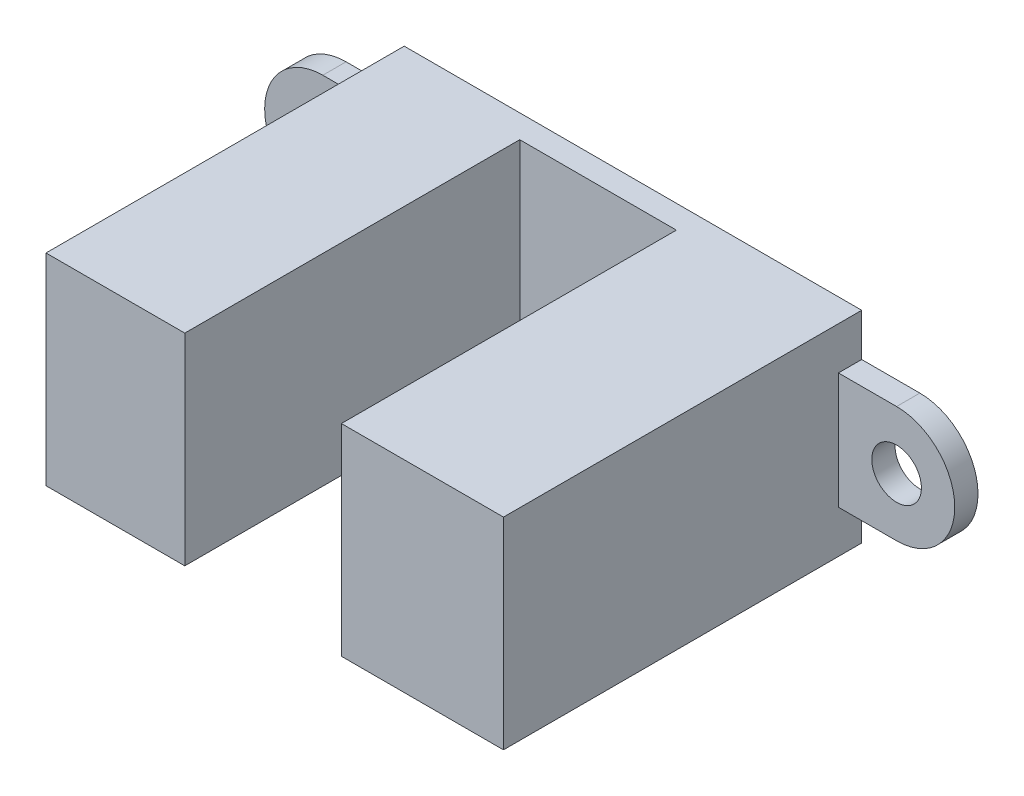
from build123d import *

# Parameters (mm, degrees)
BACK_PLATE_DEPTH               = 1.5
DETECTOR_START                 = 14.75
SKETCH2_W                      = 21.6
SKETCH2_H                      = 13
DETECTOR_SIDE_DEPTH            = 10.45
EMITTER_START                  = -14.75
SKETCH2_2_W                    = 21.6
SKETCH2_2_H                    = 13
EMITTER_SIDE_DEPTH             = 8.95
F_3_2_3_2_DIAMETER_HOLE1_D     = 3.2
F_3_2_3_2_DIAMETER_HOLE1_DEPTH = 4
F_3_2_3_2_DIAMETER_HOLE1_TIP   = 0.96137699


with BuildPart() as part:
    # Sketch1 → Back Plate (new body)
    with BuildSketch(Plane.XY):
        with BuildLine():
            ThreePointArc((-18.5, -3.75), (-15.848349571, -2.651650429), (-14.75, 0))
            ThreePointArc((-14.75, 0), (-15.848349571, 2.651650429), (-18.5, 3.75))
            Line((-18.5, 3.75), (-18.5, -3.75))
        make_face()
        with BuildLine():
            ThreePointArc((-18.5, 3.75), (-22.25, 0), (-18.5, -3.75))
            Line((-18.5, -3.75), (-18.5, 3.75))
        make_face()
        with BuildLine():
            ThreePointArc((-18.5, 3.75), (-15.848349571, 2.651650429), (-14.75, 0))
            Line((-14.75, 0), (-14.75, 3.75))
            Line((-14.75, 3.75), (-18.5, 3.75))
        make_face()
        with BuildLine():
            Line((-18.5, -3.75), (-14.75, -3.75))
            Line((-14.75, -3.75), (-14.75, 0))
            ThreePointArc((-14.75, 0), (-15.848349571, -2.651650429), (-18.5, -3.75))
        make_face()
        Polygon((-14.75, -3.75), (-14.75, -6.5), (14.75, -6.5), (14.75, -3.75), (14.75, 4e-09), (14.75, 3.75), (14.75, 6.5), (-14.75, 6.5), (-14.75, 3.75), (-14.75, 0), align=None)
        with BuildLine():
            Line((14.75, 4e-09), (14.75, -3.75))
            Line((14.75, -3.75), (18.5, -3.75))
            ThreePointArc((18.5, -3.75), (15.848349569, -2.651650428), (14.75, 4e-09))
        make_face()
        with BuildLine():
            Line((14.75, 3.75), (14.75, 4e-09))
            ThreePointArc((14.75, 4e-09), (15.848349572, 2.651650431), (18.5, 3.75))
            Line((18.5, 3.75), (14.75, 3.75))
        make_face()
        with BuildLine():
            ThreePointArc((18.5, 3.75), (15.848349572, 2.651650431), (14.75, 4e-09))
            ThreePointArc((14.75, 4e-09), (15.848349569, -2.651650428), (18.5, -3.75))
            Line((18.5, -3.75), (18.5, 3.75))
        make_face()
        with BuildLine():
            Line((18.5, 3.75), (18.5, -3.75))
            ThreePointArc((18.5, -3.75), (21.151650429, -2.651650429), (22.25, 0))
            ThreePointArc((22.25, 0), (21.151650429, 2.651650429), (18.5, 3.75))
        make_face()
    extrude(amount=BACK_PLATE_DEPTH)

    # Sketch2 → Detector Side (add)
    with BuildSketch(Plane(origin=(0, 0, 0), x_dir=(0, 0, -1), z_dir=(1, 0, 0)).offset(DETECTOR_START)):
        with Locations((-12.3, 0)):
            Rectangle(SKETCH2_W, SKETCH2_H)
    extrude(amount=-DETECTOR_SIDE_DEPTH)

    # Sketch2<2> → Emitter Side (add)
    with BuildSketch(Plane(origin=(0, 0, 0), x_dir=(0, 0, -1), z_dir=(1, 0, 0)).offset(EMITTER_START)):
        with Locations((-12.3, 0)):
            Rectangle(SKETCH2_2_W, SKETCH2_2_H)
    extrude(amount=EMITTER_SIDE_DEPTH)

    # Ø3.2 (3.2) Diameter Hole1
    with Locations(Plane(origin=(0, 0, 0), x_dir=(-1, 0, 0), z_dir=(0, 0, -1))):
        with Locations((-18.5, 0), (18.5, 0)):
            Hole(F_3_2_3_2_DIAMETER_HOLE1_D / 2, depth=F_3_2_3_2_DIAMETER_HOLE1_DEPTH)
            with Locations((0, 0, -(F_3_2_3_2_DIAMETER_HOLE1_DEPTH + F_3_2_3_2_DIAMETER_HOLE1_TIP / 2))):  # 118° drill point
                Cone(0, F_3_2_3_2_DIAMETER_HOLE1_D / 2, F_3_2_3_2_DIAMETER_HOLE1_TIP, mode=Mode.SUBTRACT)


solid = part.part
